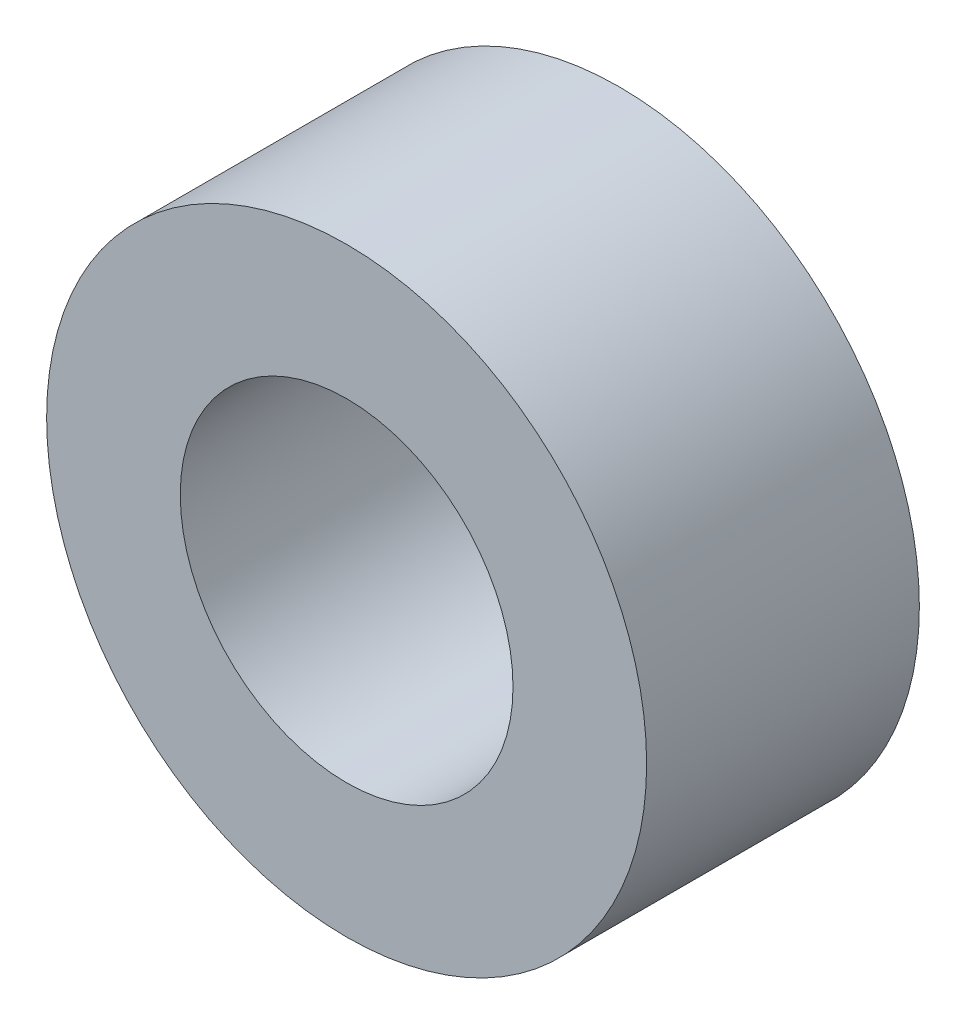
from build123d import *

# Parameters (mm, degrees)
SKETCH_1_R      = 5.5
SKETCH_1_R_2    = 3.05
EXTRUDE_1_DEPTH = 5


with BuildPart() as part:
    # 草图1 → 凸台-拉伸1 (new body)
    with BuildSketch(Plane.XY):
        Circle(SKETCH_1_R)
        Circle(SKETCH_1_R_2, mode=Mode.SUBTRACT)
    extrude(amount=EXTRUDE_1_DEPTH)


solid = part.part
